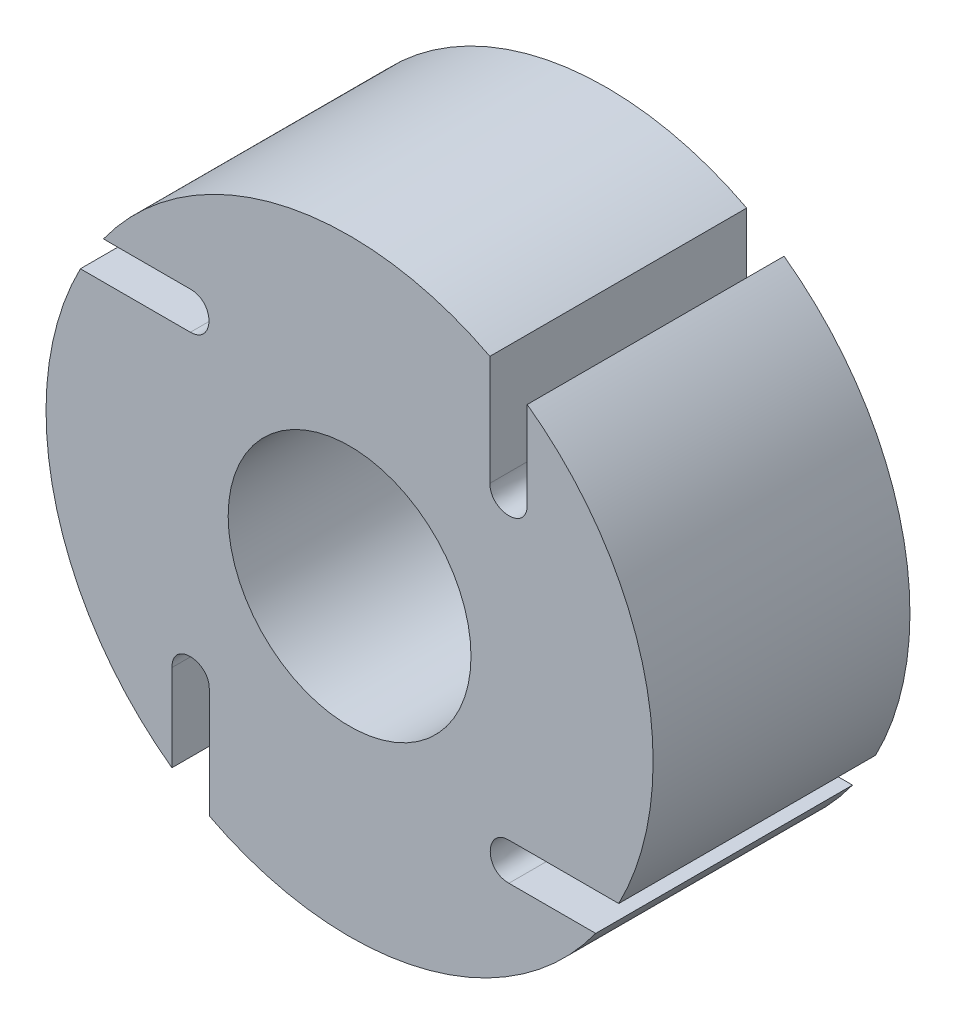
from build123d import *

# Parameters (mm, degrees)
SKETCH2_R           = 6.5
BOSS_EXTRUDE2_DEPTH = 5.5
SKETCH1_R           = 2.6
CUT_EXTRUDE1_DEPTH  = 21.193250236


with BuildPart() as part:
    # Sketch2 → Boss-Extrude2 (new body)
    with BuildSketch(Plane.XY):
        with Locations((7.165538907, 7.311965881)):
            Circle(SKETCH2_R)
    extrude(amount=-BOSS_EXTRUDE2_DEPTH)

    # Sketch1 → Cut-Extrude1 (cut, through all)
    with BuildSketch(Plane.XY):
        with Locations((7.165538907, 7.311965881)):
            Circle(SKETCH1_R)
        with BuildLine():
            Line((10.969559419, 10.723771247), (10.969559419, 13.011721187))
            add(Edge.make_bspline(
                [(10.969559419, 13.011721187), (10.958646548, 13.475622363), (10.162270372, 13.509138157), (10.169559419, 13.215491328)],
                knots=[0, 0, 0, 0, 1, 1, 1, 1], degree=3))
            Line((10.169559419, 13.215491328), (10.169559419, 10.721114654))
            add(Edge.make_bspline(
                [(10.169559419, 10.721114654), (10.169559419, 10.211921076), (10.969559419, 10.170868336), (10.969559419, 10.723771247)],
                knots=[0, 0, 0, 0, 1, 1, 1, 1], degree=3))
        make_face()
        with BuildLine():
            Line((13.069064354, 4.307945368), (10.57468768, 4.307945368))
            add(Edge.make_bspline(
                [(10.57468768, 4.307945368), (10.065494102, 4.307945368), (10.024441362, 3.507945368), (10.577344274, 3.507945368)],
                knots=[0, 0, 0, 0, 1, 1, 1, 1], degree=3))
            Line((10.577344274, 3.507945368), (12.865294213, 3.507945368))
            add(Edge.make_bspline(
                [(12.865294213, 3.507945368), (13.329195389, 3.518858239), (13.362711183, 4.315234416), (13.069064354, 4.307945368)],
                knots=[0, 0, 0, 0, 1, 1, 1, 1], degree=3))
        make_face()
        with BuildLine():
            Line((4.161518395, 1.408440433), (4.161518395, 3.902817107))
            add(Edge.make_bspline(
                [(4.161518395, 3.902817107), (4.161518395, 4.412010686), (3.361518395, 4.453063426), (3.361518395, 3.900160514)],
                knots=[0, 0, 0, 0, 1, 1, 1, 1], degree=3))
            Line((3.361518395, 3.900160514), (3.361518395, 1.612210574))
            add(Edge.make_bspline(
                [(3.361518395, 1.612210574), (3.372431266, 1.148309399), (4.168807442, 1.114793605), (4.161518395, 1.408440433)],
                knots=[0, 0, 0, 0, 1, 1, 1, 1], degree=3))
        make_face()
        with BuildLine():
            Line((1.26201346, 10.315986393), (3.756390133, 10.315986393))
            add(Edge.make_bspline(
                [(3.756390133, 10.315986393), (4.265583712, 10.315986393), (4.306636452, 11.115986393), (3.75373354, 11.115986393)],
                knots=[0, 0, 0, 0, 1, 1, 1, 1], degree=3))
            Line((3.75373354, 11.115986393), (1.465783601, 11.115986393))
            add(Edge.make_bspline(
                [(1.465783601, 11.115986393), (1.001882425, 11.105073522), (0.968366631, 10.308697346), (1.26201346, 10.315986393)],
                knots=[0, 0, 0, 0, 1, 1, 1, 1], degree=3))
        make_face()
    extrude(amount=-CUT_EXTRUDE1_DEPTH, mode=Mode.SUBTRACT)


solid = part.part
